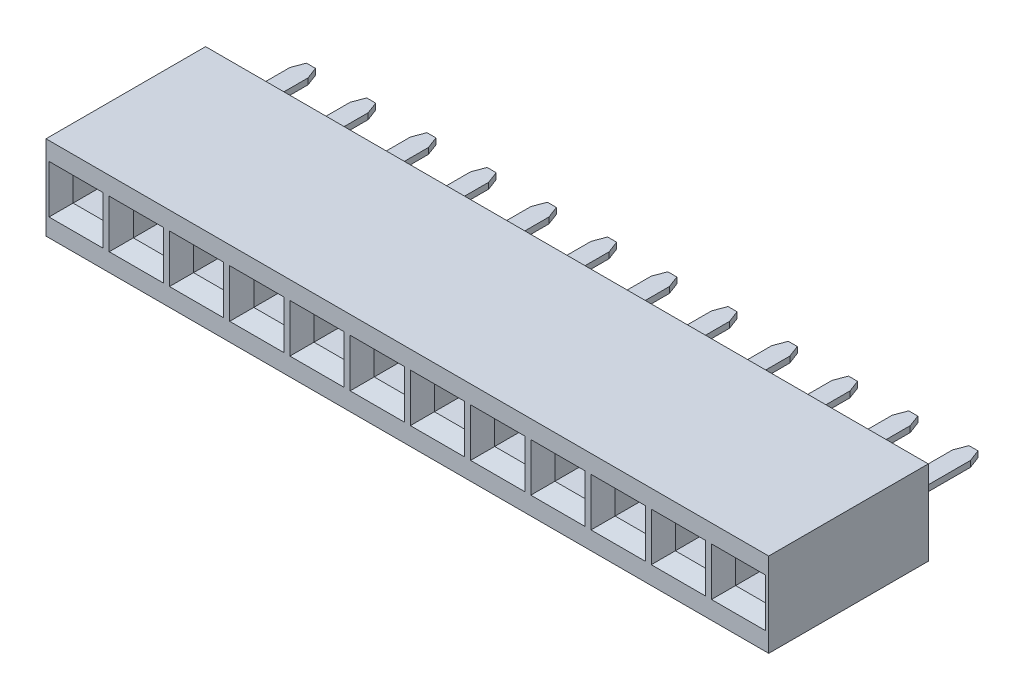
from build123d import *

# Parameters (mm, degrees)
SKETCH1_W                  = 2.54
SKETCH1_H                  = 3.556
BOSS_EXTRUDE1_DEPTH        = 6.731
SKETCH2_W                  = 1.27
SKETCH2_H                  = 1.016
CUT_EXTRUDE1_DEPTH         = 5.461
CHAMFER1_SIZE              = 0.508
BOSS_EXTRUDE2_START        = -1.778
BOSS_EXTRUDE2_DEPTH        = 0.127
LPATTERN1_COUNT            = 12
LPATTERN1_PITCH            = 2.54
CHAMFER1_OF_LPATTERN1_SIZE = 0.508


with BuildPart() as part:
    # Sketch1 → Boss-Extrude1 (new body)
    with BuildSketch(Plane.XY):
        Rectangle(SKETCH1_W, SKETCH1_H)
    boss_extrude1 = extrude(amount=BOSS_EXTRUDE1_DEPTH)

    # Sketch2 → Cut-Extrude1 (cut)
    with BuildSketch(Plane.XY.offset(6.731)):
        Rectangle(SKETCH2_W, SKETCH2_H)
    cut_extrude1 = extrude(amount=-CUT_EXTRUDE1_DEPTH, mode=Mode.SUBTRACT)

    # Chamfer1
    chamfer1_edges = [part.edges().sort_by_distance(p)[0] for p in [
        (-0.635, 0, 6.731),
        (0, -0.508, 6.731),
        (0.635, 0, 6.731),
        (0, 0.508, 6.731),
    ]]
    chamfer(chamfer1_edges, length=CHAMFER1_SIZE)

    # Sketch3 → Boss-Extrude2 (add, symmetric)
    with BuildSketch(Plane(origin=(0, 1.778, 0), x_dir=(1, 0, 0), z_dir=(0, 1, 0)).offset(BOSS_EXTRUDE2_START)):
        Polygon((-0.381, 0), (-0.381, 2.667), (-0.1905, 3.175), (0.1905, 3.175), (0.381, 2.667), (0.381, 0), align=None)
    boss_extrude2 = extrude(amount=BOSS_EXTRUDE2_DEPTH, both=True)

    # LPattern1: Boss-Extrude1, Cut-Extrude1, Boss-Extrude2 ×12
    with Locations(*[(i * LPATTERN1_PITCH, 0, 0) for i in range(1, LPATTERN1_COUNT)]):
        add(boss_extrude1)
        add(cut_extrude1, mode=Mode.SUBTRACT)
        add(boss_extrude2)

    # Chamfer1 of LPattern1
    chamfer1_of_lpattern1_edges = [part.edges().sort_by_distance(p)[0] for p in [
        (1.905, 0, 6.731),
        (2.54, -0.508, 6.731),
        (3.175, 0, 6.731),
        (2.54, 0.508, 6.731),
        (4.445, 0, 6.731),
        (5.08, -0.508, 6.731),
        (5.715, 0, 6.731),
        (5.08, 0.508, 6.731),
        (6.985, 0, 6.731),
        (7.62, -0.508, 6.731),
        (8.255, 0, 6.731),
        (7.62, 0.508, 6.731),
        (9.525, 0, 6.731),
        (10.16, -0.508, 6.731),
        (10.795, 0, 6.731),
        (10.16, 0.508, 6.731),
        (12.065, 0, 6.731),
        (12.7, -0.508, 6.731),
        (13.335, 0, 6.731),
        (12.7, 0.508, 6.731),
        (14.605, 0, 6.731),
        (15.24, -0.508, 6.731),
        (15.875, 0, 6.731),
        (15.24, 0.508, 6.731),
        (17.145, 0, 6.731),
        (17.78, -0.508, 6.731),
        (18.415, 0, 6.731),
        (17.78, 0.508, 6.731),
        (19.685, 0, 6.731),
        (20.32, -0.508, 6.731),
        (20.955, 0, 6.731),
        (20.32, 0.508, 6.731),
        (22.225, 0, 6.731),
        (22.86, -0.508, 6.731),
        (23.495, 0, 6.731),
        (22.86, 0.508, 6.731),
        (24.765, 0, 6.731),
        (25.4, -0.508, 6.731),
        (26.035, 0, 6.731),
        (25.4, 0.508, 6.731),
        (27.305, 0, 6.731),
        (27.94, -0.508, 6.731),
        (28.575, 0, 6.731),
        (27.94, 0.508, 6.731),
    ]]
    chamfer(chamfer1_of_lpattern1_edges, length=CHAMFER1_OF_LPATTERN1_SIZE)


solid = part.part
